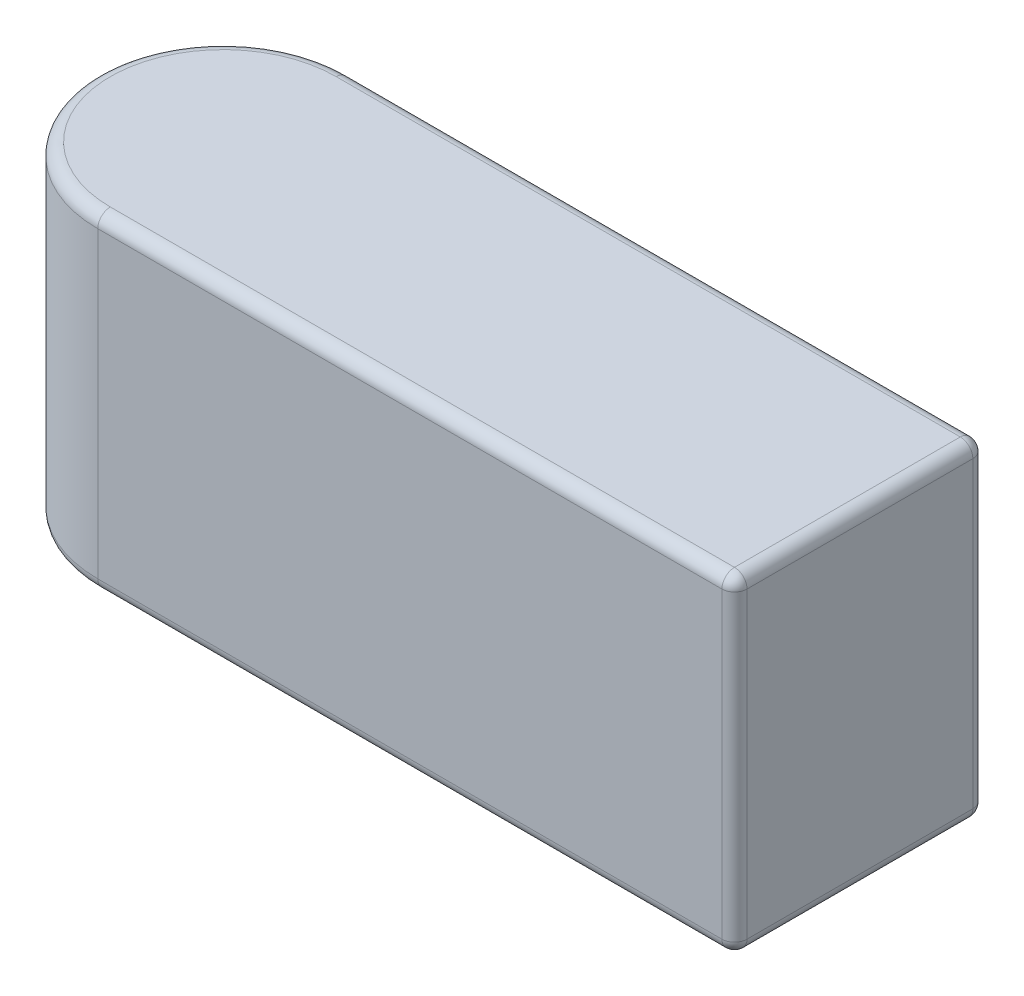
from build123d import *

# Parameters (mm, degrees)
SKETCH1_W           = 77.1525
SKETCH1_H           = 33.2359
BOSS_EXTRUDE1_DEPTH = 25.4
CUT_EXTRUDE1_DEPTH  = 57.902654708
FILLET1_R           = 1.27


with BuildPart() as part:
    # Sketch1 → Boss-Extrude1 (new body)
    with BuildSketch(Plane.XY):
        Rectangle(SKETCH1_W, SKETCH1_H)
    extrude(amount=BOSS_EXTRUDE1_DEPTH)

    # Sketch2 → Cut-Extrude1 (cut, through all)
    with BuildSketch(Plane(origin=(0, 16.61795, 0), x_dir=(1, 0, 0), z_dir=(0, 1, 0))):
        with BuildLine():
            Line((-25.87625, 0), (-51.27625, 0))
            Line((-51.27625, 0), (-51.27625, -25.4))
            Line((-51.27625, -25.4), (-25.87625, -25.4))
            ThreePointArc((-25.87625, -25.4), (-34.856506121, -21.680256121), (-38.57625, -12.7))
            ThreePointArc((-38.57625, -12.7), (-34.856506121, -3.719743879), (-25.87625, 0))
        make_face()
    extrude(amount=-CUT_EXTRUDE1_DEPTH, mode=Mode.SUBTRACT)

    # Fillet1
    fillet1_edges = [part.edges().sort_by_distance(p)[0] for p in [
        (6.35, -16.61795, 0),
        (6.35, -16.61795, 25.4),
        (-38.57625, -16.61795, 12.7),
        (-38.57625, 16.61795, 12.7),
        (38.57625, 0, 25.4),
        (6.35, 16.61795, 0),
        (38.57625, 0, 0),
        (38.57625, -16.61795, 12.7),
        (38.57625, 16.61795, 12.7),
        (6.35, 16.61795, 25.4),
    ]]
    fillet(fillet1_edges, radius=FILLET1_R)


solid = part.part
